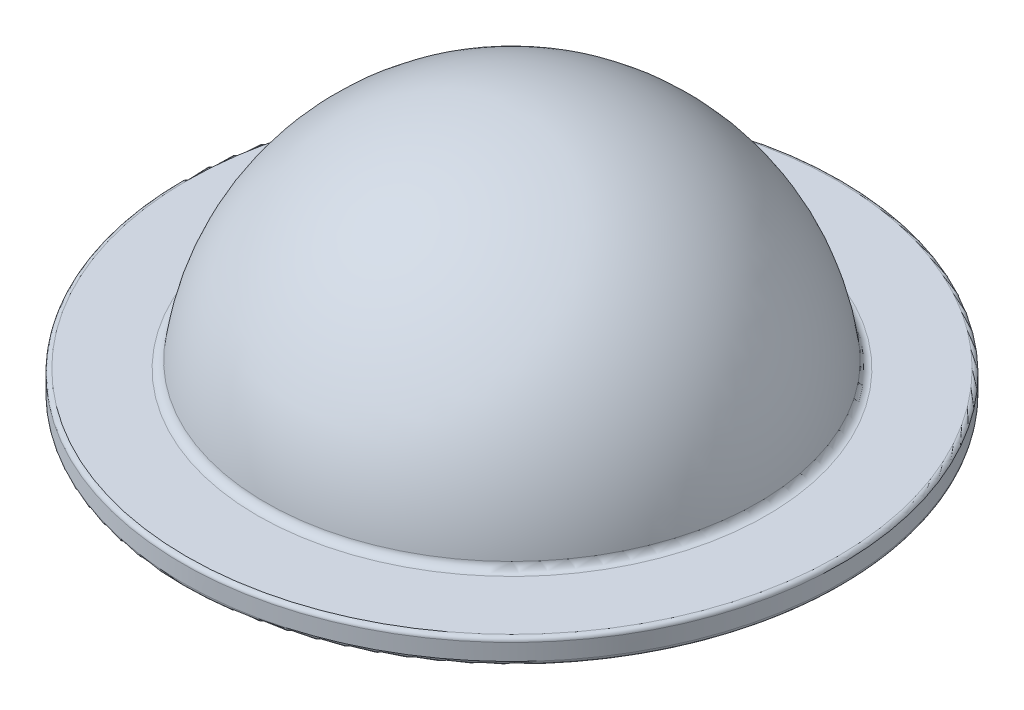
from build123d import *

# Parameters (mm, degrees)
FILLET_1_R = 1
FILLET_2_R = 3
FILLET_3_R = 0.5


with BuildPart() as part:
    # 草图1 → 旋转4 (revolve)
    with BuildSketch(Plane.XY):
        with BuildLine():
            Line((-27.149626863, 0), (-40, 0))
            Line((-40, 0), (-40, 3))
            Line((-40, 3), (-30, 3))
            ThreePointArc((-30, 3), (-20.230560044, 22.354517223), (0, 30.149626863))
            Line((0, 30.149626863), (0, 27.149626863))
            ThreePointArc((0, 27.149626863), (-19.197685262, 19.197685262), (-27.149626863, 0))
        make_face()
    revolve(axis=Axis((0, 27.149626863, 0), (0, 1, 0)))

    # 圆角1
    fillet_1_edges = [part.edges().sort_by_distance(p)[0] for p in [
        (30, 3, 0),
    ]]
    fillet(fillet_1_edges, radius=FILLET_1_R)

    # 圆角2
    fillet_2_edges = [part.edges().sort_by_distance(p)[0] for p in [
        (27.149626863, 0, 0),
    ]]
    fillet(fillet_2_edges, radius=FILLET_2_R)

    # 圆角3
    fillet_3_edges = [part.edges().sort_by_distance(p)[0] for p in [
        (40, 3, 0),
        (40, 0, 0),
    ]]
    fillet(fillet_3_edges, radius=FILLET_3_R)


solid = part.part
